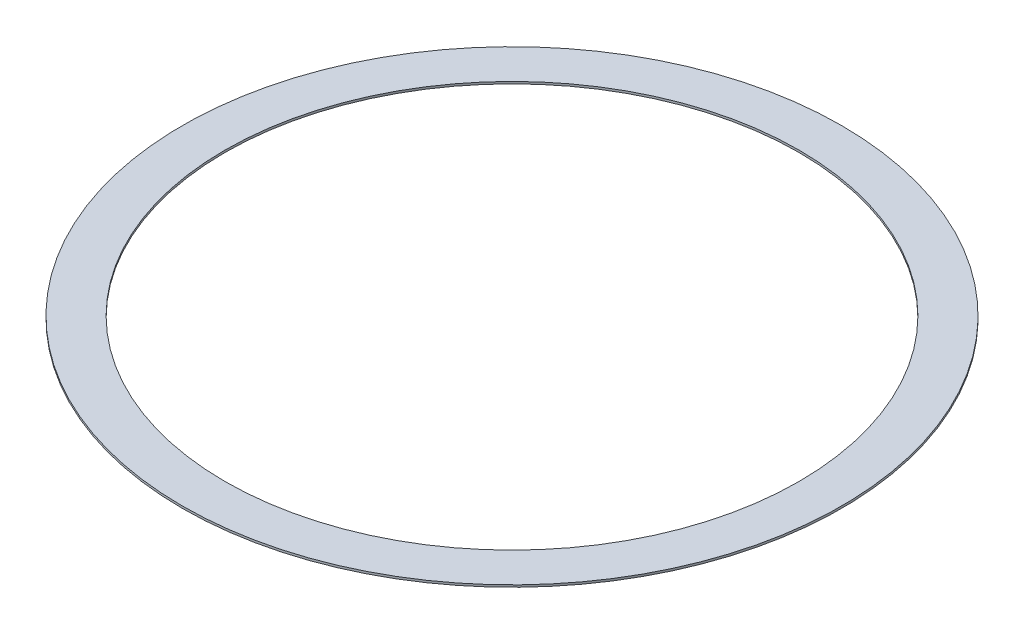
from build123d import *

# Parameters (mm, degrees)
SKETCH1_R           = 15.5
SKETCH1_R_2         = 13.5
BOSS_EXTRUDE1_DEPTH = 0.1


with BuildPart() as part:
    # Sketch1 → Boss-Extrude1 (new body)
    with BuildSketch(Plane(origin=(0, 0, 0), x_dir=(1, 0, 0), z_dir=(0, 1, 0))):
        with Locations(Location((0, 0, 0), (0, 0, 270))):
            Circle(SKETCH1_R)
        with Locations(Location((0, 0, 0), (0, 0, 270))):
            Circle(SKETCH1_R_2, mode=Mode.SUBTRACT)
    extrude(amount=BOSS_EXTRUDE1_DEPTH)


solid = part.part
